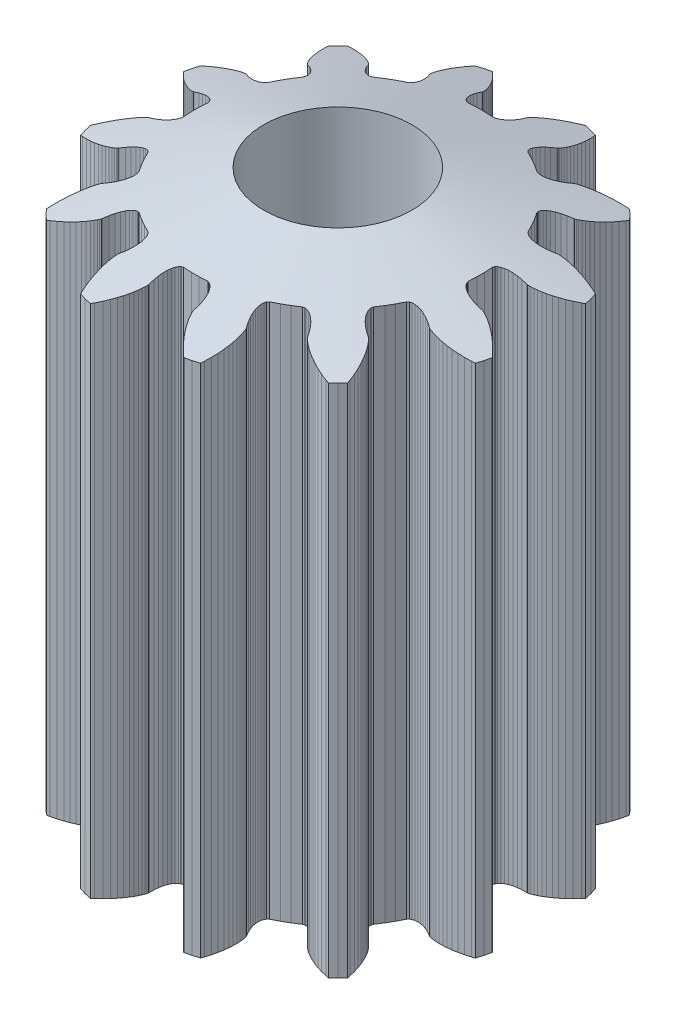
from build123d import *

# Parameters (mm, degrees)
BOSS_EXTRUDE3_DEPTH = 24
CUT_EXTRUDE2_DEPTH  = 27.957595102


with BuildPart() as part:
    # Sketch4 → Boss-Extrude3 (new body)
    with BuildSketch(Plane(origin=(0, 0, 0), x_dir=(1, 0, 0), z_dir=(0, 1, 0))):
        Polygon((-8.514154269, 2.591520468), (-8.600532227, 2.306770502), (-8.668101704, 2.016980819), (-8.582535159, 1.918957192), (-8.406382101, 1.73729734), (-8.235487485, 1.578593831), (-8.071731561, 1.441761367), (-7.916893513, 1.325582897), (-7.772642932, 1.228717315), (-7.640531833, 1.149707686), (-7.521987223, 1.086989958), (-7.418304279, 1.038902136), (-7.33064013, 1.003693857), (-7.260008302, 0.979536349), (-7.207273811, 0.964532721), (-7.20104707, 0.963108698), (-7.17128186, 0.965774744), (-6.967550359, 0.966777275), (-6.783785979, 0.950125513), (-6.621224107, 0.917931364), (-6.480932873, 0.872384795), (-6.363808518, 0.815742074), (-6.270571529, 0.750313743), (-6.201763575, 0.678452376), (-6.157745236, 0.602540177), (-6.138694542, 0.524976457), (-6.157745236, 0.16146757), (-6.157745236, -0.16146757), (-6.138694542, -0.524976457), (-6.157745236, -0.602540177), (-6.201763575, -0.678452376), (-6.270571529, -0.750313743), (-6.363808518, -0.815742074), (-6.480932873, -0.872384795), (-6.621224107, -0.917931364), (-6.783785979, -0.950125513), (-6.967550359, -0.966777275), (-7.17128186, -0.965774744), (-7.20104707, -0.963108698), (-7.207273811, -0.964532721), (-7.260008302, -0.979536349), (-7.33064013, -1.003693857), (-7.418304279, -1.038902136), (-7.521987223, -1.086989958), (-7.640531833, -1.149707686), (-7.772642932, -1.228717315), (-7.916893513, -1.325582897), (-8.071731561, -1.441761367), (-8.235487485, -1.578593831), (-8.406382101, -1.73729734), (-8.582535159, -1.918957192), (-8.668101704, -2.016980819), (-8.600532227, -2.306770502), (-8.514154269, -2.591520468), (-8.391039654, -2.633628146), (-8.147656705, -2.702873665), (-7.920305872, -2.754867627), (-7.71007285, -2.791490054), (-7.517889931, -2.814684536), (-7.344532473, -2.826447301), (-7.19061609, -2.828816098), (-7.056594583, -2.823858938), (-6.942758608, -2.813662741), (-6.849235089, -2.800321931), (-6.775987377, -2.785927033), (-6.722816154, -2.77255331), (-6.716711627, -2.77067318), (-6.692267222, -2.753481712), (-6.516331832, -2.650747744), (-6.348861329, -2.573286402), (-6.191981544, -2.519886417), (-6.047712487, -2.489185286), (-5.917958459, -2.479677144), (-5.804498693, -2.489721246), (-5.708978573, -2.517551038), (-5.632901474, -2.561283762), (-5.577621229, -2.618930567), (-5.41236517, -2.943263844), (-5.2508976, -3.222933879), (-5.052644772, -3.528216463), (-5.030361297, -3.604913962), (-5.030526197, -3.692665025), (-5.05418495, -3.789302771), (-5.102216385, -3.892583862), (-5.175327692, -4.000200075), (-5.27405018, -4.109790178), (-5.398735816, -4.218952065), (-5.549554557, -4.325255103), (-5.726492478, -4.426252636), (-5.753602929, -4.438826378), (-5.758283433, -4.443172989), (-5.796451028, -4.482533757), (-5.845541232, -4.538770687), (-5.903856472, -4.613094026), (-5.969604625, -4.706580773), (-6.040908404, -4.820168223), (-6.115815158, -4.954648119), (-6.192307034, -5.110661465), (-6.268311482, -5.288693995), (-6.341712041, -5.489072346), (-6.410359365, -5.711960925), (-6.472082461, -5.957359501), (-6.49717345, -6.085033725), (-6.293761725, -6.302214213), (-6.076581237, -6.505625938), (-5.948907013, -6.480534949), (-5.703508437, -6.418811853), (-5.480619858, -6.350164529), (-5.280241507, -6.276763971), (-5.102208976, -6.200759522), (-4.946195631, -6.124267646), (-4.811715735, -6.049360892), (-4.698128285, -5.978057113), (-4.604641537, -5.91230896), (-4.530318199, -5.85399372), (-4.474081269, -5.804903516), (-4.434720501, -5.766735921), (-4.43037389, -5.762055417), (-4.417800148, -5.734944966), (-4.316802615, -5.558007045), (-4.210499577, -5.407188304), (-4.10133769, -5.282502668), (-3.991747587, -5.18378018), (-3.884131374, -5.110668874), (-3.780850283, -5.062637438), (-3.684212536, -5.038978685), (-3.596461474, -5.038813785), (-3.519763975, -5.06109726), (-3.214481391, -5.259350088), (-2.934811356, -5.420817658), (-2.610478079, -5.586073717), (-2.552831274, -5.641353962), (-2.50909855, -5.717431062), (-2.481268758, -5.812951181), (-2.471224656, -5.926410948), (-2.480732798, -6.056164975), (-2.511433929, -6.200434032), (-2.564833914, -6.357313818), (-2.642295256, -6.52478432), (-2.745029224, -6.70071971), (-2.762220692, -6.725164115), (-2.764100822, -6.731268642), (-2.777474545, -6.784439865), (-2.791869443, -6.857687577), (-2.805210253, -6.951211096), (-2.81540645, -7.065047071), (-2.82036361, -7.199068578), (-2.817994813, -7.352984961), (-2.806232048, -7.526342419), (-2.783037566, -7.718525338), (-2.746415139, -7.92875836), (-2.694421177, -8.156109193), (-2.625175658, -8.399492142), (-2.583067979, -8.522606758), (-2.298318014, -8.608984715), (-2.008528331, -8.676554192), (-1.910504704, -8.590987647), (-1.728844851, -8.41483459), (-1.570141343, -8.243939974), (-1.433308879, -8.08018405), (-1.317130409, -7.925346001), (-1.220264827, -7.781095421), (-1.141255197, -7.648984321), (-1.07853747, -7.530439712), (-1.030449648, -7.426756767), (-0.995241369, -7.339092618), (-0.971083861, -7.26846079), (-0.956080233, -7.215726299), (-0.954656209, -7.209499558), (-0.957322255, -7.179734348), (-0.958324787, -6.976002847), (-0.941673025, -6.792238467), (-0.909478876, -6.629676595), (-0.863932307, -6.489385361), (-0.807289586, -6.372261006), (-0.741861255, -6.279024017), (-0.669999888, -6.210216063), (-0.594087689, -6.166197724), (-0.516523969, -6.14714703), (-0.153015082, -6.166197724), (0.169920058, -6.166197724), (0.533428945, -6.14714703), (0.610992665, -6.166197724), (0.686904864, -6.210216063), (0.758766231, -6.279024017), (0.824194562, -6.372261006), (0.880837283, -6.489385361), (0.926383852, -6.629676595), (0.958578002, -6.792238467), (0.975229763, -6.976002847), (0.974227232, -7.179734348), (0.971561186, -7.209499558), (0.972985209, -7.215726299), (0.987988837, -7.26846079), (1.012146345, -7.339092618), (1.047354625, -7.426756767), (1.095442446, -7.530439712), (1.158160174, -7.648984321), (1.237169803, -7.781095421), (1.334035386, -7.925346001), (1.450213855, -8.08018405), (1.587046319, -8.243939974), (1.745749828, -8.41483459), (1.92740968, -8.590987647), (2.025433308, -8.676554192), (2.31522299, -8.608984715), (2.599972956, -8.522606758), (2.642080634, -8.399492142), (2.711326153, -8.156109193), (2.763320115, -7.92875836), (2.799942543, -7.718525338), (2.823137025, -7.526342419), (2.834899789, -7.352984961), (2.837268586, -7.199068578), (2.832311426, -7.065047071), (2.822115229, -6.951211096), (2.80877442, -6.857687577), (2.794379521, -6.784439865), (2.781005798, -6.731268642), (2.779125668, -6.725164115), (2.7619342, -6.70071971), (2.659200232, -6.52478432), (2.58173889, -6.357313818), (2.528338905, -6.200434032), (2.497637774, -6.056164975), (2.488129632, -5.926410948), (2.498173734, -5.812951181), (2.526003526, -5.717431062), (2.56973625, -5.641353962), (2.627383055, -5.586073717), (2.951716332, -5.420817658), (3.231386367, -5.259350088), (3.536668951, -5.06109726), (3.61336645, -5.038813785), (3.701117513, -5.038978685), (3.797755259, -5.062637438), (3.90103635, -5.110668874), (4.008652563, -5.18378018), (4.118242666, -5.282502668), (4.227404553, -5.407188304), (4.333707592, -5.558007045), (4.434705124, -5.734944966), (4.447278866, -5.762055417), (4.451625477, -5.766735921), (4.490986245, -5.804903516), (4.547223175, -5.85399372), (4.621546514, -5.91230896), (4.715033261, -5.978057113), (4.828620711, -6.049360892), (4.963100607, -6.124267646), (5.119113953, -6.200759522), (5.297146483, -6.276763971), (5.497524835, -6.350164529), (5.720413413, -6.418811853), (5.965811989, -6.480534949), (6.093486213, -6.505625938), (6.310666701, -6.302214213), (6.514078426, -6.085033725), (6.488987438, -5.957359501), (6.427264342, -5.711960925), (6.358617017, -5.489072346), (6.285216459, -5.288693995), (6.20921201, -5.110661465), (6.132720134, -4.954648119), (6.057813381, -4.820168223), (5.986509601, -4.706580773), (5.920761448, -4.613094026), (5.862446208, -4.538770687), (5.813356004, -4.482533757), (5.775188409, -4.443172989), (5.770507905, -4.438826378), (5.743397454, -4.426252636), (5.566459533, -4.325255103), (5.415640792, -4.218952065), (5.290955156, -4.109790178), (5.192232669, -4.000200075), (5.119121362, -3.892583862), (5.071089926, -3.789302771), (5.047431173, -3.692665025), (5.047266273, -3.604913962), (5.069549749, -3.528216463), (5.267802577, -3.222933879), (5.429270147, -2.943263844), (5.594526206, -2.618930567), (5.64980645, -2.561283762), (5.72588355, -2.517551038), (5.821403669, -2.489721246), (5.934863436, -2.479677144), (6.064617464, -2.489185286), (6.20888652, -2.519886417), (6.365766306, -2.573286402), (6.533236808, -2.650747744), (6.709172198, -2.753481712), (6.733616603, -2.77067318), (6.73972113, -2.77255331), (6.792892353, -2.785927033), (6.866140065, -2.800321931), (6.959663584, -2.813662741), (7.073499559, -2.823858938), (7.207521066, -2.828816098), (7.361437449, -2.826447301), (7.534794908, -2.814684536), (7.726977826, -2.791490054), (7.937210848, -2.754867627), (8.164561681, -2.702873665), (8.40794463, -2.633628146), (8.531059246, -2.591520468), (8.617437203, -2.306770502), (8.68500668, -2.016980819), (8.599440135, -1.918957192), (8.423287078, -1.73729734), (8.252392462, -1.578593831), (8.088636538, -1.441761367), (7.933798489, -1.325582897), (7.789547909, -1.228717315), (7.657436809, -1.149707686), (7.5388922, -1.086989958), (7.435209255, -1.038902136), (7.347545107, -1.003693857), (7.276913278, -0.979536349), (7.224178787, -0.964532721), (7.217952046, -0.963108698), (7.188186836, -0.965774744), (6.984455335, -0.966777275), (6.800690955, -0.950125513), (6.638129083, -0.917931364), (6.497837849, -0.872384795), (6.380713494, -0.815742074), (6.287476505, -0.750313743), (6.218668551, -0.678452376), (6.174650212, -0.602540177), (6.155599518, -0.524976457), (6.174650212, -0.16146757), (6.174650212, 0.16146757), (6.155599518, 0.524976457), (6.174650212, 0.602540177), (6.218668551, 0.678452376), (6.287476505, 0.750313743), (6.380713494, 0.815742074), (6.497837849, 0.872384795), (6.638129083, 0.917931364), (6.800690955, 0.950125513), (6.984455335, 0.966777275), (7.188186836, 0.965774744), (7.217952046, 0.963108698), (7.224178787, 0.964532721), (7.276913278, 0.979536349), (7.347545107, 1.003693857), (7.435209255, 1.038902136), (7.5388922, 1.086989958), (7.657436809, 1.149707686), (7.789547909, 1.228717315), (7.933798489, 1.325582897), (8.088636538, 1.441761367), (8.252392462, 1.578593831), (8.423287078, 1.73729734), (8.599440135, 1.918957192), (8.68500668, 2.016980819), (8.617437203, 2.306770502), (8.531059246, 2.591520468), (8.40794463, 2.633628146), (8.164561681, 2.702873665), (7.937210848, 2.754867627), (7.726977826, 2.791490054), (7.534794908, 2.814684536), (7.361437449, 2.826447301), (7.207521066, 2.828816098), (7.073499559, 2.823858938), (6.959663584, 2.813662741), (6.866140065, 2.800321931), (6.792892353, 2.785927033), (6.73972113, 2.77255331), (6.733616603, 2.77067318), (6.709172198, 2.753481712), (6.533236808, 2.650747744), (6.365766306, 2.573286402), (6.20888652, 2.519886417), (6.064617464, 2.489185286), (5.934863436, 2.479677144), (5.821403669, 2.489721246), (5.72588355, 2.517551038), (5.64980645, 2.561283762), (5.594526206, 2.618930567), (5.429270147, 2.943263844), (5.267802577, 3.222933879), (5.069549749, 3.528216463), (5.047266273, 3.604913962), (5.047431173, 3.692665025), (5.071089926, 3.789302771), (5.119121362, 3.892583862), (5.192232669, 4.000200075), (5.290955156, 4.109790178), (5.415640792, 4.218952065), (5.566459533, 4.325255103), (5.743397454, 4.426252636), (5.770507905, 4.438826378), (5.775188409, 4.443172989), (5.813356004, 4.482533757), (5.862446208, 4.538770687), (5.920761448, 4.613094026), (5.986509601, 4.706580773), (6.057813381, 4.820168223), (6.132720134, 4.954648119), (6.20921201, 5.110661465), (6.285216459, 5.288693995), (6.358617017, 5.489072346), (6.427264342, 5.711960925), (6.488987438, 5.957359501), (6.514078426, 6.085033725), (6.310666701, 6.302214213), (6.093486213, 6.505625938), (5.965811989, 6.480534949), (5.720413413, 6.418811853), (5.497524835, 6.350164529), (5.297146483, 6.276763971), (5.119113953, 6.200759522), (4.963100607, 6.124267646), (4.828620711, 6.049360892), (4.715033261, 5.978057113), (4.621546514, 5.91230896), (4.547223175, 5.85399372), (4.490986245, 5.804903516), (4.451625477, 5.766735921), (4.447278866, 5.762055417), (4.434705124, 5.734944966), (4.333707592, 5.558007045), (4.227404553, 5.407188304), (4.118242666, 5.282502668), (4.008652563, 5.18378018), (3.90103635, 5.110668874), (3.797755259, 5.062637438), (3.701117513, 5.038978685), (3.61336645, 5.038813785), (3.536668951, 5.06109726), (3.231386367, 5.259350088), (2.951716332, 5.420817658), (2.627383055, 5.586073717), (2.56973625, 5.641353962), (2.526003526, 5.717431062), (2.498173734, 5.812951181), (2.488129632, 5.926410948), (2.497637774, 6.056164975), (2.528338905, 6.200434032), (2.58173889, 6.357313818), (2.659200232, 6.52478432), (2.7619342, 6.70071971), (2.779125668, 6.725164115), (2.781005798, 6.731268642), (2.794379521, 6.784439865), (2.80877442, 6.857687577), (2.822115229, 6.951211096), (2.832311426, 7.065047071), (2.837268586, 7.199068578), (2.834899789, 7.352984961), (2.823137025, 7.526342419), (2.799942543, 7.718525338), (2.763320115, 7.92875836), (2.711326153, 8.156109193), (2.642080634, 8.399492142), (2.599972956, 8.522606758), (2.31522299, 8.608984715), (2.025433308, 8.676554192), (1.92740968, 8.590987647), (1.745749828, 8.41483459), (1.587046319, 8.243939974), (1.450213855, 8.08018405), (1.334035386, 7.925346001), (1.237169803, 7.781095421), (1.158160174, 7.648984321), (1.095442446, 7.530439712), (1.047354625, 7.426756767), (1.012146345, 7.339092618), (0.987988837, 7.26846079), (0.972985209, 7.215726299), (0.971561186, 7.209499558), (0.974227232, 7.179734348), (0.975229763, 6.976002847), (0.958578002, 6.792238467), (0.926383852, 6.629676595), (0.880837283, 6.489385361), (0.824194562, 6.372261006), (0.758766231, 6.279024017), (0.686904864, 6.210216063), (0.610992665, 6.166197724), (0.533428945, 6.14714703), (0.169920058, 6.166197724), (-0.153015082, 6.166197724), (-0.516523969, 6.14714703), (-0.594087689, 6.166197724), (-0.669999888, 6.210216063), (-0.741861255, 6.279024017), (-0.807289586, 6.372261006), (-0.863932307, 6.489385361), (-0.909478876, 6.629676595), (-0.941673025, 6.792238467), (-0.958324787, 6.976002847), (-0.957322255, 7.179734348), (-0.954656209, 7.209499558), (-0.956080233, 7.215726299), (-0.971083861, 7.26846079), (-0.995241369, 7.339092618), (-1.030449648, 7.426756767), (-1.07853747, 7.530439712), (-1.141255197, 7.648984321), (-1.220264827, 7.781095421), (-1.317130409, 7.925346001), (-1.433308879, 8.08018405), (-1.570141343, 8.243939974), (-1.728844851, 8.41483459), (-1.910504704, 8.590987647), (-2.008528331, 8.676554192), (-2.298318014, 8.608984715), (-2.583067979, 8.522606758), (-2.625175658, 8.399492142), (-2.694421177, 8.156109193), (-2.746415139, 7.92875836), (-2.783037566, 7.718525338), (-2.806232048, 7.526342419), (-2.817994813, 7.352984961), (-2.82036361, 7.199068578), (-2.81540645, 7.065047071), (-2.805210253, 6.951211096), (-2.791869443, 6.857687577), (-2.777474545, 6.784439865), (-2.764100822, 6.731268642), (-2.762220692, 6.725164115), (-2.745029224, 6.70071971), (-2.642295256, 6.52478432), (-2.564833914, 6.357313818), (-2.511433929, 6.200434032), (-2.480732798, 6.056164975), (-2.471224656, 5.926410948), (-2.481268758, 5.812951181), (-2.50909855, 5.717431062), (-2.552831274, 5.641353962), (-2.610478079, 5.586073717), (-2.934811356, 5.420817658), (-3.214481391, 5.259350088), (-3.519763975, 5.06109726), (-3.596461474, 5.038813785), (-3.684212536, 5.038978685), (-3.780850282, 5.062637438), (-3.884131374, 5.110668874), (-3.991747587, 5.18378018), (-4.10133769, 5.282502668), (-4.210499577, 5.407188304), (-4.316802615, 5.558007045), (-4.417800148, 5.734944966), (-4.43037389, 5.762055417), (-4.434720501, 5.766735921), (-4.474081269, 5.804903516), (-4.530318199, 5.85399372), (-4.604641537, 5.91230896), (-4.698128285, 5.978057113), (-4.811715735, 6.049360892), (-4.946195631, 6.124267646), (-5.102208976, 6.200759522), (-5.280241507, 6.276763971), (-5.480619858, 6.350164529), (-5.703508437, 6.418811853), (-5.948907013, 6.480534949), (-6.076581237, 6.505625938), (-6.293761725, 6.302214213), (-6.49717345, 6.085033725), (-6.472082461, 5.957359501), (-6.410359365, 5.711960925), (-6.341712041, 5.489072346), (-6.268311482, 5.288693995), (-6.192307034, 5.110661465), (-6.115815158, 4.954648119), (-6.040908404, 4.820168223), (-5.969604625, 4.706580773), (-5.903856472, 4.613094026), (-5.845541232, 4.538770687), (-5.796451028, 4.482533757), (-5.758283433, 4.443172989), (-5.753602929, 4.438826378), (-5.726492478, 4.426252636), (-5.549554557, 4.325255103), (-5.398735816, 4.218952065), (-5.27405018, 4.109790178), (-5.175327692, 4.000200075), (-5.102216385, 3.892583862), (-5.05418495, 3.789302771), (-5.030526197, 3.692665025), (-5.030361297, 3.604913962), (-5.052644772, 3.528216463), (-5.2508976, 3.222933879), (-5.41236517, 2.943263844), (-5.577621229, 2.618930567), (-5.632901474, 2.561283762), (-5.708978573, 2.517551038), (-5.804498693, 2.489721246), (-5.917958459, 2.479677144), (-6.047712487, 2.489185286), (-6.191981544, 2.519886417), (-6.348861329, 2.573286402), (-6.516331832, 2.650747744), (-6.692267222, 2.753481712), (-6.716711627, 2.77067318), (-6.722816154, 2.77255331), (-6.775987377, 2.785927033), (-6.849235089, 2.800321931), (-6.942758608, 2.813662741), (-7.056594583, 2.823858938), (-7.19061609, 2.828816098), (-7.344532473, 2.826447301), (-7.517889931, 2.814684536), (-7.71007285, 2.791490054), (-7.920305872, 2.754867627), (-8.147656705, 2.702873665), (-8.391039654, 2.633628146), align=None)
    extrude(amount=BOSS_EXTRUDE3_DEPTH)

    # Sketch5 → Cut-Extrude2 (cut, through all)
    with BuildSketch(Plane.XZ):
        with BuildLine():
            Line((2.25, -2.275412051), (2.25, 2.275412051))
            ThreePointArc((2.25, 2.275412051), (0, 3.2), (-2.25, 2.275412051))
            Line((-2.25, 2.275412051), (-2.25, -2.275412051))
            ThreePointArc((-2.25, -2.275412051), (0, -3.2), (2.25, -2.275412051))
        make_face()
        with BuildLine():
            ThreePointArc((3.2, 0), (2.952964612, 1.232882801), (2.25, 2.275412051))
            Line((2.25, 2.275412051), (2.25, -2.275412051))
            ThreePointArc((2.25, -2.275412051), (2.952964612, -1.232882801), (3.2, 0))
        make_face()
        with BuildLine():
            Line((-2.25, -2.275412051), (-2.25, 2.275412051))
            ThreePointArc((-2.25, 2.275412051), (-3.2, 0), (-2.25, -2.275412051))
        make_face()
    extrude(amount=-CUT_EXTRUDE2_DEPTH, mode=Mode.SUBTRACT)

    # Sketch6 → Cut-Revolve1 (revolve, cut)
    with BuildSketch(Plane.XY, mode=Mode.PRIVATE) as cut_revolve1_sk:
        Polygon((3.2, 24), (9.7, 24), (9.7, 22), align=None)
    revolve(cut_revolve1_sk.sketch.rotate(Axis((0, 0, 0), (0, 1, 0)), 90), axis=Axis((0, 0, 0), (0, 1, 0)), mode=Mode.SUBTRACT)


solid = part.part
